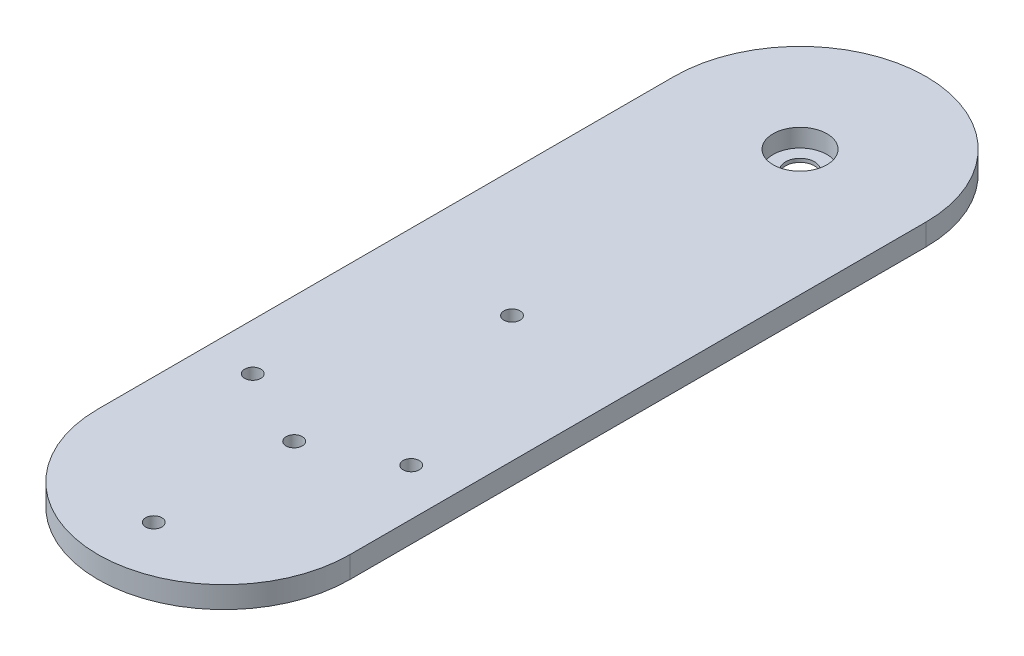
from build123d import *

# Parameters (mm, degrees)
PLACA_START                   = -52.75
SK_PLACA_W                    = 70
SK_PLACA_H                    = 160
PLACA_DEPTH                   = 6
EXTREMOS_START                = -52.75
SK_EXTREMOS_R                 = 35
EXTREMOS_DEPTH                = 6
PASANTES_M4_SEPARADORES_START = -52.75
SK_PASANTES_M4_SEPARADORES_R  = 2.25
PASANTES_M4_SEPARADORES_DEPTH = 6
ALOJAMIENTO_696ZZ_START       = -51.75
SK_ALOJAMIENTO_696ZZ_R        = 7.475
ALOJAMIENTO_696ZZ_DEPTH       = 5
PASO_EXTRACTOR_START          = -52.75
SK_PASO_EXTRACTOR_R           = 4
PASO_EXTRACTOR_DEPTH          = 1
PASANTES_M4_EJEFALSO_J3_START = -52.75
SK_PASANTES_M4_EJEFALSO_J3_R  = 2.25
PASANTES_M4_EJEFALSO_J3_DEPTH = 6


with BuildPart() as part:
    # Sk_Placa → Placa (new body)
    with BuildSketch(Plane(origin=(0, 0, 0), x_dir=(1, 0, 0), z_dir=(0, 1, 0)).offset(PLACA_START)):
        with Locations((0, -250)):
            Rectangle(SK_PLACA_W, SK_PLACA_H)
    extrude(amount=PLACA_DEPTH)

    # Sk_Extremos → Extremos (add)
    with BuildSketch(Plane(origin=(0, 0, 0), x_dir=(1, 0, 0), z_dir=(0, 1, 0)).offset(EXTREMOS_START)):
        with Locations((0, -170)):
            Circle(SK_EXTREMOS_R)
        with Locations((0, -330)):
            Circle(SK_EXTREMOS_R)
    extrude(amount=EXTREMOS_DEPTH)

    # Sk_Pasantes_M4_separadores → Pasantes_M4_separadores (cut)
    with BuildSketch(Plane(origin=(0, 0, 0), x_dir=(1, 0, 0), z_dir=(0, 1, 0)).offset(PASANTES_M4_SEPARADORES_START)):
        with Locations(Location((0, -250, 0), (0, 0, 270))):
            Circle(SK_PASANTES_M4_SEPARADORES_R)
        with Locations(Location((-22, -300, 0), (0, 0, 270))):
            Circle(SK_PASANTES_M4_SEPARADORES_R)
        with Locations(Location((22, -300, 0), (0, 0, 270))):
            Circle(SK_PASANTES_M4_SEPARADORES_R)
    extrude(amount=PASANTES_M4_SEPARADORES_DEPTH, mode=Mode.SUBTRACT)

    # Sk_Alojamiento_696ZZ → Alojamiento_696ZZ (cut)
    with BuildSketch(Plane(origin=(0, 0, 0), x_dir=(1, 0, 0), z_dir=(0, 1, 0)).offset(ALOJAMIENTO_696ZZ_START)):
        with Locations(Location((0, -170, 0), (0, 0, 270))):
            Circle(SK_ALOJAMIENTO_696ZZ_R)
    extrude(amount=ALOJAMIENTO_696ZZ_DEPTH, mode=Mode.SUBTRACT)

    # Sk_Paso_extractor → Paso_extractor (cut)
    with BuildSketch(Plane(origin=(0, 0, 0), x_dir=(1, 0, 0), z_dir=(0, 1, 0)).offset(PASO_EXTRACTOR_START)):
        with Locations(Location((0, -170, 0), (0, 0, 270))):
            Circle(SK_PASO_EXTRACTOR_R)
    extrude(amount=PASO_EXTRACTOR_DEPTH, mode=Mode.SUBTRACT)

    # Sk_Pasantes_M4_ejefalso_J3 → Pasantes_M4_ejefalso_J3 (cut)
    with BuildSketch(Plane(origin=(0, 0, 0), x_dir=(1, 0, 0), z_dir=(0, 1, 0)).offset(PASANTES_M4_EJEFALSO_J3_START)):
        with Locations(Location((0, -310.5, 0), (0, 0, 270))):
            Circle(SK_PASANTES_M4_EJEFALSO_J3_R)
        with Locations(Location((0, -349.5, 0), (0, 0, 270))):
            Circle(SK_PASANTES_M4_EJEFALSO_J3_R)
    extrude(amount=PASANTES_M4_EJEFALSO_J3_DEPTH, mode=Mode.SUBTRACT)


solid = part.part
